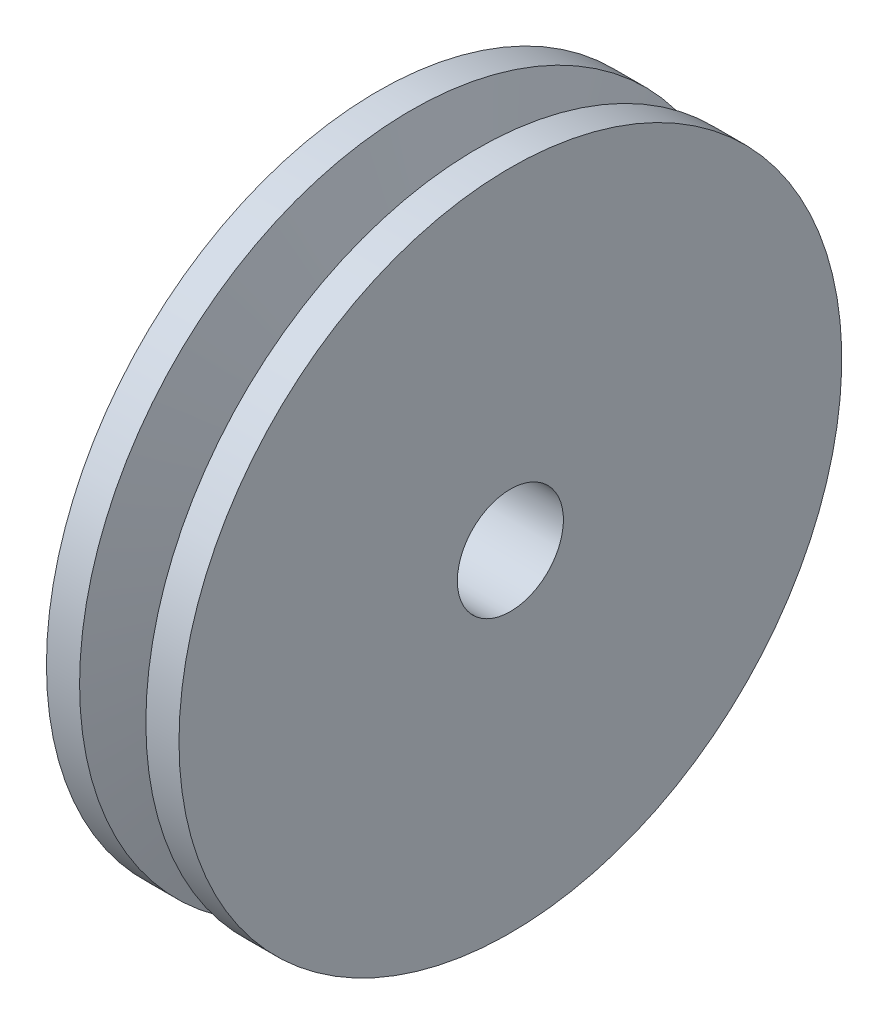
from build123d import *

# Parameters (mm, degrees)
SKETCH2_R          = 4
CUT_EXTRUDE1_DEPTH = 10


with BuildPart() as part:
    # Sketch1 → Revolve1 (revolve)
    with BuildSketch(Plane(origin=(0, 0, 0), x_dir=(1, 0, 0), z_dir=(0, 1, 0)), mode=Mode.PRIVATE) as revolve1_sk:
        Polygon((5, 0), (-5, 0), (-5, 25), (-2.5, 25), (0, 15), (2.5, 25), (5, 25), align=None)
    revolve(revolve1_sk.sketch.rotate(Axis((-18.958333333, 0, 0), (1, 0, 0)), 180), axis=Axis((-18.958333333, 0, 0), (1, 0, 0)))

    # Sketch2 → Cut-Extrude1 (cut)
    with BuildSketch(Plane.ZY.offset(5)):
        Circle(SKETCH2_R)
    extrude(amount=-CUT_EXTRUDE1_DEPTH, mode=Mode.SUBTRACT)


solid = part.part
